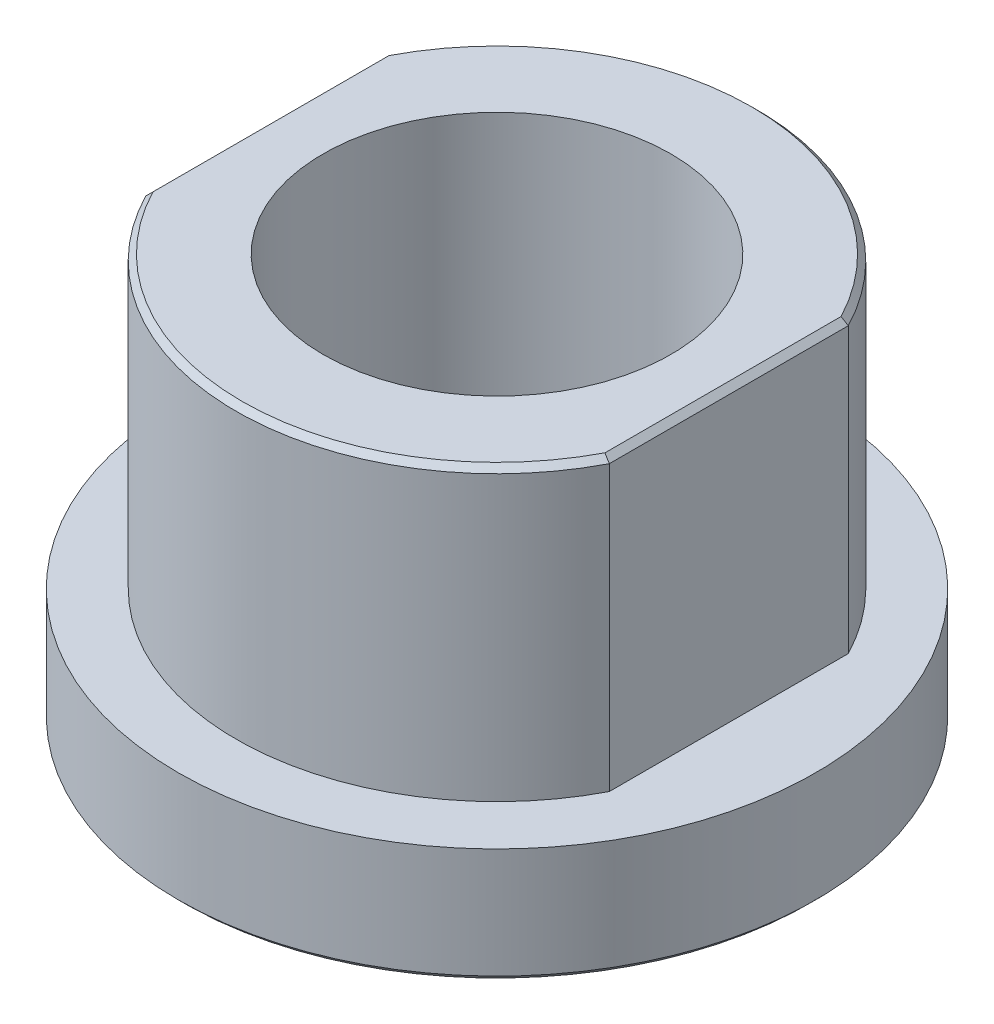
from build123d import *

# Parameters (mm, degrees)
CUT_EXTRUDE1_DEPTH      = 11.464224768
CUT_EXTRUDE1_DEPTH_BACK = 5
CHAMFER1_SIZE           = 0.1


with BuildPart() as part:
    # Sketch1 → Revolve1 (revolve)
    with BuildSketch(Plane.XY, mode=Mode.PRIVATE) as revolve1_sk:
        Polygon((3, 0), (5.5, 0), (5.5, 2), (4.5, 2), (4.5, 7), (3, 7), align=None)
    revolve(revolve1_sk.sketch.rotate(Axis((0, 0, 0), (0, 1, 0)), 90), axis=Axis((0, 0, 0), (0, 1, 0)))

    # Sketch2 → Cut-Extrude1 (cut, two sides: drawn at the far end of the back side and taken through both)
    with BuildSketch(Plane(origin=(0, 7, 0), x_dir=(1, 0, 0), z_dir=(0, 1, 0)).offset(-CUT_EXTRUDE1_DEPTH_BACK)):
        with BuildLine():
            Line((-4, 2.061552813), (-4, -2.061552813))
            ThreePointArc((-4, -2.061552813), (-4.5, 0), (-4, 2.061552813))
        make_face()
        with BuildLine():
            Line((4, 2.061552813), (4, -2.061552813))
            ThreePointArc((4, -2.061552813), (4.5, 0), (4, 2.061552813))
        make_face()
    extrude(amount=CUT_EXTRUDE1_DEPTH + CUT_EXTRUDE1_DEPTH_BACK, mode=Mode.SUBTRACT)

    # Chamfer1
    chamfer1_edges = [part.edges().sort_by_distance(p)[0] for p in [
        (0, 7, 4.5),
        (0, 7, -4.5),
        (4, 7, 0),
        (-4, 7, 0),
        (0, 0, 5.5),
    ]]
    chamfer(chamfer1_edges, length=CHAMFER1_SIZE)


solid = part.part
